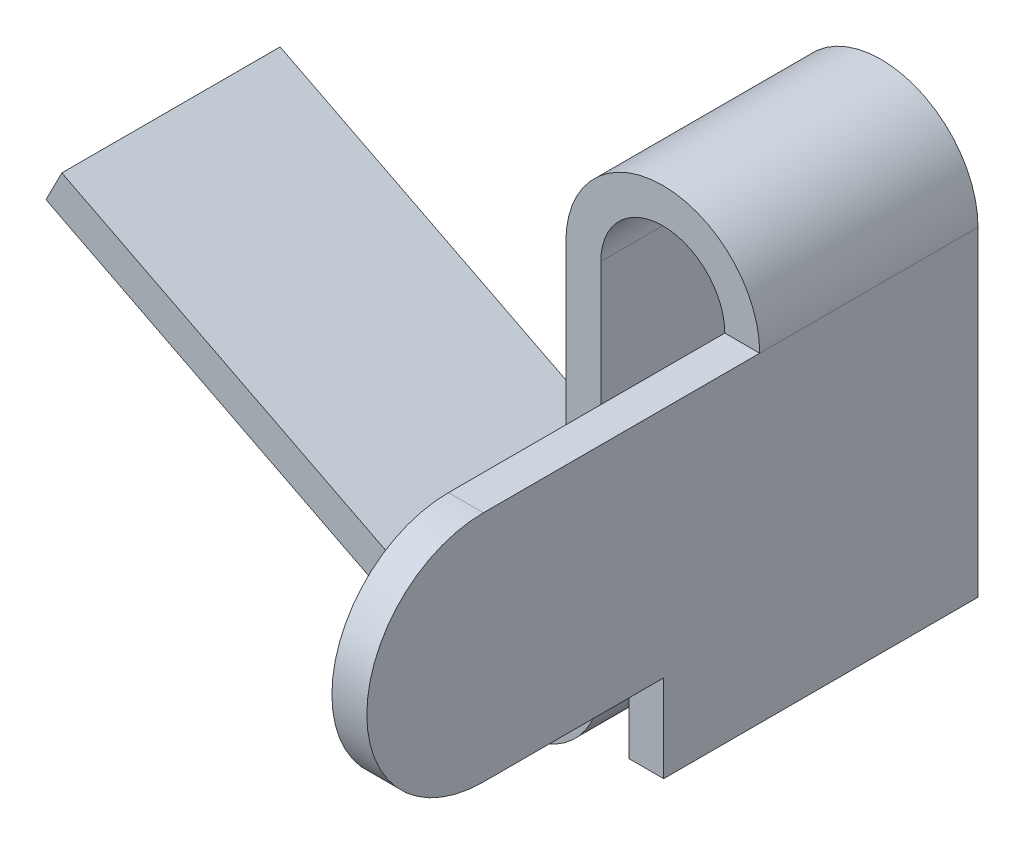
from build123d import *

# Parameters (mm, degrees)
SURFACE_EXTRUDE1_1_DEPTH = 2.5
THICKEN1_T1              = 0.4
SKETCH2_W                = 0.4
SKETCH2_H                = 3.67
BOSS_EXTRUDE1_DEPTH      = 4.5
CUT_EXTRUDE1_REACH       = 13.776
SKETCH3_W                = 3.4
SKETCH3_H                = 1
FILLET2_RADIUS           = 1.335
FILLET2_LENGTH           = 0.4


with BuildPart() as body_1:
    # Surface-Extrude1: a surface, the sketch's curves swept straight by 2.5 mm
    with BuildLine(Plane.XY, mode=Mode.PRIVATE) as surface_extrude1_1_path:
        Line((-7.064526383, 1.105941224), (-2.1639905, -1.391006524))
        ThreePointArc((-2.1639905, -1.391006524), (-1.187501435, -1.352640164), (-0.71, -0.5))
        Line((-0.71, -0.5), (-0.71, 0))
        Line((-0.71, 0), (-0.71, 3.67))
        ThreePointArc((-0.71, 3.67), (0, 4.38), (0.71, 3.67))
        Line((0.71, 3.67), (0.71, 0))
    surface_extrude1_1 = Shell.extrude(surface_extrude1_1_path.wire(), (0 * SURFACE_EXTRUDE1_1_DEPTH, 0 * SURFACE_EXTRUDE1_1_DEPTH, 1 * SURFACE_EXTRUDE1_1_DEPTH))
    add(Solid.thicken(surface_extrude1_1, THICKEN1_T1))

    # Sketch2 → Boss-Extrude1 (add)
    with BuildSketch(Plane.XY.offset(2.5)):
        with Locations((0.91, 1.835)):
            Rectangle(SKETCH2_W, SKETCH2_H)
    extrude(amount=BOSS_EXTRUDE1_DEPTH)

    # Sketch3 → Cut-Extrude1 (cut, up to next)
    with BuildSketch(Plane(origin=(1.11, 0, 0), x_dir=(0, 0, -1), z_dir=(1, 0, 0)), mode=Mode.PRIVATE) as cut_extrude1_sk1:
        with Locations((-5.3, 0.5)):
            Rectangle(SKETCH3_W, SKETCH3_H)
    cut_extrude1_tool1 = extrude(cut_extrude1_sk1.sketch, amount=-CUT_EXTRUDE1_REACH, mode=Mode.PRIVATE) & body_1.part
    add(cut_extrude1_tool1.solids().sort_by_distance((1.11, 0.5, 5.3))[0], mode=Mode.SUBTRACT)

    # Fillet2: full round fillet: the end face becomes a half cylinder, R = half its width
    fillet2_face = Plane((0.91, 2.335, 7), x_dir=(-1, 0, 0), z_dir=(0, 0, 1))  # on the end face: x along it, z out of the body
    fillet2_slab = fillet2_face.offset(-FILLET2_RADIUS / 2) * Box(FILLET2_LENGTH, 2 * FILLET2_RADIUS, FILLET2_RADIUS, mode=Mode.PRIVATE)  # the body's end, R deep
    fillet2_round = Plane((0.91, 2.335, 5.665), x_dir=(0, 0, 1), z_dir=(-1, 0, 0)) * Cylinder(FILLET2_RADIUS, FILLET2_LENGTH, mode=Mode.PRIVATE)  # its axis R under the face
    add(fillet2_slab - fillet2_round, mode=Mode.SUBTRACT)


solid = body_1.part
